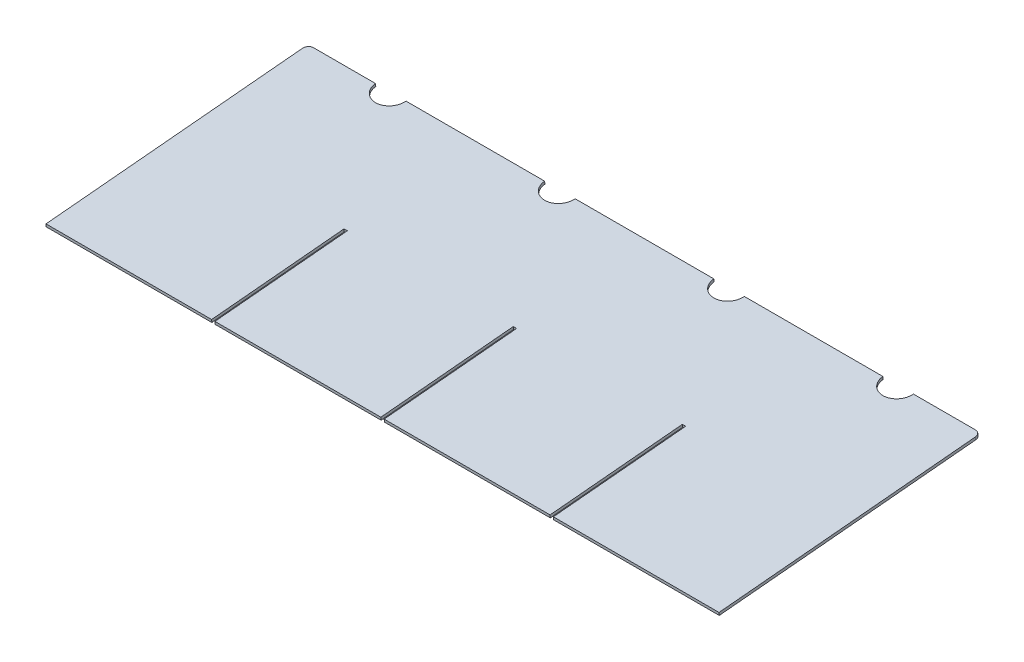
from build123d import *

# Parameters (mm, degrees)
EXTRUDE_1_DEPTH = 1


with BuildPart() as part:
    # 草图1 → 凸台-拉伸1 (new body)
    with BuildSketch(Plane(origin=(0, 53.933062278, 5.010311528), x_dir=(-1, 0, 0), z_dir=(5.133494296529154e-15, 0.9957126460708378, 0.09250041326724258))):
        with BuildLine():
            Line((-121.5, 905.593751703), (-121.5, 812.593751703))
            ThreePointArc((-121.5, 812.593751703), (-120.914213563, 811.179538141), (-119.5, 810.593751703))
            Line((-119.5, 810.593751703), (-97.1, 810.593751703))
            ThreePointArc((-97.1, 810.593751703), (-91.6, 816.093751703), (-86.1, 810.593751703))
            Line((-86.1, 810.593751703), (-36.05, 810.593751703))
            ThreePointArc((-36.05, 810.593751703), (-30.55, 816.093751703), (-25.05, 810.593751703))
            Line((-25.05, 810.593751703), (25.05, 810.593751703))
            ThreePointArc((25.05, 810.593751703), (30.55, 816.093751703), (36.05, 810.593751703))
            Line((36.05, 810.593751703), (86.1, 810.593751703))
            ThreePointArc((86.1, 810.593751703), (91.6, 816.093751703), (97.1, 810.593751703))
            Line((97.1, 810.593751703), (119.5, 810.593751703))
            ThreePointArc((119.5, 810.593751703), (120.914213562, 811.179538141), (121.5, 812.593751703))
            Line((121.5, 812.593751703), (121.5, 905.593751703))
            Line((121.5, 905.593751703), (61.7, 905.593751703))
            Line((61.7, 905.593751703), (61.7, 857.583834348))
            Line((61.7, 857.583834348), (60.5, 857.593751703))
            Line((60.5, 857.593751703), (60.5, 905.593751703))
            Line((60.5, 905.593751703), (0.6, 905.593751703))
            Line((0.6, 905.593751703), (0.6, 857.593751703))
            Line((0.6, 857.593751703), (-0.6, 857.593751703))
            Line((-0.6, 857.593751703), (-0.6, 905.593751703))
            Line((-0.6, 905.593751703), (-60.5, 905.593751703))
            Line((-60.5, 905.593751703), (-60.5, 857.603476177))
            Line((-60.5, 857.603476177), (-61.7, 857.593751703))
            Line((-61.7, 857.593751703), (-61.7, 905.593751703))
            Line((-61.7, 905.593751703), (-121.5, 905.593751703))
        make_face()
    extrude(amount=-EXTRUDE_1_DEPTH)


solid = part.part
